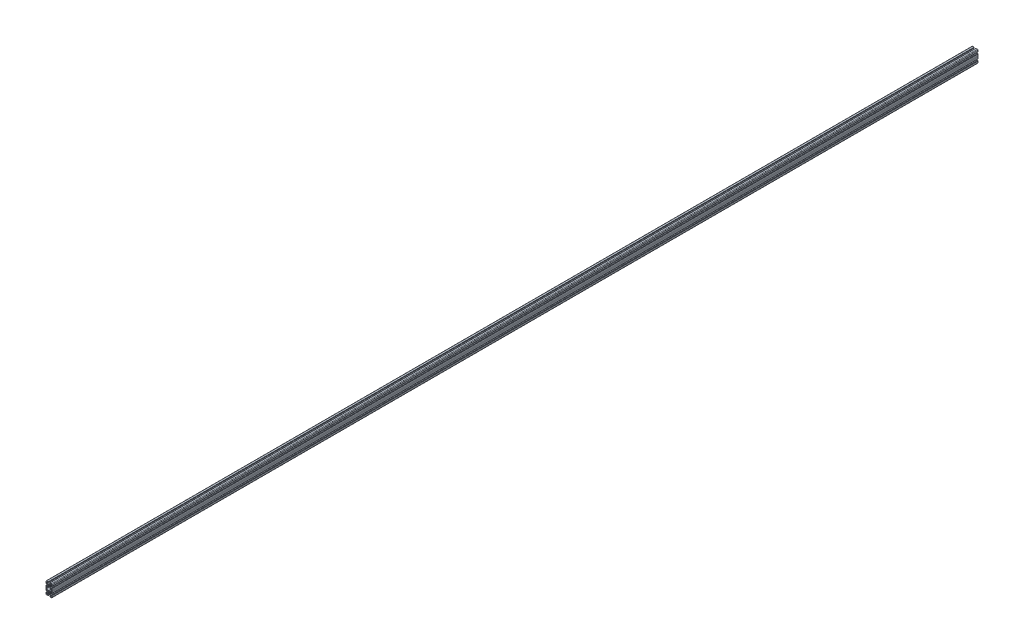
from build123d import *

# Parameters (mm, degrees)
SKETCH3_R           = 2.15
BOSS_EXTRUDE1_DEPTH = 1524
CIRPATTERN1_COUNT   = 2


with BuildPart() as part:
    # Sketch3 → Boss-Extrude1 (new, symmetric)
    with BuildSketch(Plane.XY):
        with BuildLine():
            Line((-8.30911066, 7.475083014), (-9.008684239, 7.499512662))
            ThreePointArc((-9.008684239, 7.499512662), (-9.582202525, 7.285082961), (-9.836116498, 6.727919597))
            Line((-9.836116498, 6.727919597), (-9.986803685, 2.412803152))
            ThreePointArc((-9.986803685, 2.412803152), (-9.995837451, 2.069746735), (-9.99898368, 1.726585818))
            Line((-9.99898368, 1.726585818), (-10, 0))
            Line((-10, 0), (-7.916458339, 0))
            ThreePointArc((-7.916458339, 0), (-7.764217404, 0.765366865), (-7.330671901, 1.414213562))
            Line((-7.330671901, 1.414213562), (-3.22356512, 5.521320344))
            ThreePointArc((-3.22356512, 5.521320344), (-2.250295073, 6.171638598), (-1.102244776, 6.4))
            Line((-1.102244776, 6.4), (1.102244776, 6.4))
            ThreePointArc((1.102244776, 6.4), (2.250295073, 6.171638598), (3.22356512, 5.521320344))
            Line((3.22356512, 5.521320344), (7.330671901, 1.414213562))
            ThreePointArc((7.330671901, 1.414213562), (7.764217404, 0.765366865), (7.916458339, 0))
            Line((7.916458339, 0), (10, 0))
            Line((10, 0), (9.99898368, 1.726585818))
            ThreePointArc((9.99898368, 1.726585818), (9.995837451, 2.069746735), (9.986803685, 2.412803152))
            Line((9.986803685, 2.412803152), (9.836116498, 6.727919597))
            ThreePointArc((9.836116498, 6.727919597), (9.582202525, 7.285082961), (9.008684239, 7.499512662))
            Line((9.008684239, 7.499512662), (8.30911066, 7.475083014))
            ThreePointArc((8.30911066, 7.475083014), (8.100174399, 7.379865274), (8.019763261, 7.164795917))
            Line((8.019763261, 7.164795917), (8.093719461, 5.046967452))
            ThreePointArc((8.093719461, 5.046967452), (7.631170264, 4.313871343), (6.779559917, 4.47555462))
            Line((6.779559917, 4.47555462), (4.478679656, 6.77643488))
            ThreePointArc((4.478679656, 6.77643488), (3.828361402, 7.749704927), (3.6, 8.897755224))
            Line((3.6, 8.897755224), (3.6, 11.102244776))
            ThreePointArc((3.6, 11.102244776), (3.828361402, 12.250295073), (4.478679656, 13.22356512))
            Line((4.478679656, 13.22356512), (6.779559917, 15.52444538))
            ThreePointArc((6.779559917, 15.52444538), (7.631170264, 15.686128657), (8.093719461, 14.953032548))
            Line((8.093719461, 14.953032548), (8.019763261, 12.835204083))
            ThreePointArc((8.019763261, 12.835204083), (8.100174399, 12.620134726), (8.30911066, 12.524916986))
            Line((8.30911066, 12.524916986), (9.008684239, 12.500487338))
            ThreePointArc((9.008684239, 12.500487338), (9.582202525, 12.714917039), (9.836116498, 13.272080403))
            Line((9.836116498, 13.272080403), (9.998781654, 17.930201007))
            ThreePointArc((9.998781654, 17.930201007), (9.414213562, 19.414213562), (7.930201007, 19.998781654))
            Line((7.930201007, 19.998781654), (3.272080403, 19.836116498))
            ThreePointArc((3.272080403, 19.836116498), (2.714917039, 19.582202525), (2.500487338, 19.008684239))
            Line((2.500487338, 19.008684239), (2.524916986, 18.30911066))
            ThreePointArc((2.524916986, 18.30911066), (2.620134726, 18.100174399), (2.835204083, 18.019763261))
            Line((2.835204083, 18.019763261), (4.953032548, 18.093719461))
            ThreePointArc((4.953032548, 18.093719461), (5.686128657, 17.631170264), (5.52444538, 16.779559917))
            Line((5.52444538, 16.779559917), (3.22356512, 14.478679656))
            ThreePointArc((3.22356512, 14.478679656), (2.250295073, 13.828361402), (1.102244776, 13.6))
            Line((1.102244776, 13.6), (-1.102244776, 13.6))
            ThreePointArc((-1.102244776, 13.6), (-2.250295073, 13.828361402), (-3.22356512, 14.478679656))
            Line((-3.22356512, 14.478679656), (-5.52444538, 16.779559917))
            ThreePointArc((-5.52444538, 16.779559917), (-5.686128657, 17.631170264), (-4.953032548, 18.093719461))
            Line((-4.953032548, 18.093719461), (-2.835204083, 18.019763261))
            ThreePointArc((-2.835204083, 18.019763261), (-2.620134726, 18.100174399), (-2.524916986, 18.30911066))
            Line((-2.524916986, 18.30911066), (-2.500487338, 19.008684239))
            ThreePointArc((-2.500487338, 19.008684239), (-2.714917039, 19.582202525), (-3.272080403, 19.836116498))
            Line((-3.272080403, 19.836116498), (-7.930201007, 19.998781654))
            ThreePointArc((-7.930201007, 19.998781654), (-9.414213562, 19.414213562), (-9.998781654, 17.930201007))
            Line((-9.998781654, 17.930201007), (-9.836116498, 13.272080403))
            ThreePointArc((-9.836116498, 13.272080403), (-9.582202525, 12.714917039), (-9.008684239, 12.500487338))
            Line((-9.008684239, 12.500487338), (-8.30911066, 12.524916986))
            ThreePointArc((-8.30911066, 12.524916986), (-8.100174399, 12.620134726), (-8.019763261, 12.835204083))
            Line((-8.019763261, 12.835204083), (-8.093719461, 14.953032548))
            ThreePointArc((-8.093719461, 14.953032548), (-7.631170264, 15.686128657), (-6.779559917, 15.52444538))
            Line((-6.779559917, 15.52444538), (-4.478679656, 13.22356512))
            ThreePointArc((-4.478679656, 13.22356512), (-3.828361402, 12.250295073), (-3.6, 11.102244776))
            Line((-3.6, 11.102244776), (-3.6, 8.897755224))
            ThreePointArc((-3.6, 8.897755224), (-3.828361402, 7.749704927), (-4.478679656, 6.77643488))
            Line((-4.478679656, 6.77643488), (-6.779559917, 4.47555462))
            ThreePointArc((-6.779559917, 4.47555462), (-7.631170264, 4.313871343), (-8.093719461, 5.046967452))
            Line((-8.093719461, 5.046967452), (-8.019763261, 7.164795917))
            ThreePointArc((-8.019763261, 7.164795917), (-8.100174399, 7.379865274), (-8.30911066, 7.475083014))
        make_face()
        with Locations((0, 10)):
            Circle(SKETCH3_R, mode=Mode.SUBTRACT)
    boss_extrude1 = extrude(amount=BOSS_EXTRUDE1_DEPTH, both=True)

    # CirPattern1: Boss-Extrude1 ×2 about axis
    cirpattern1_axis = Axis((0, 0, 0), (0, 0, 1))
    for i in range(1, CIRPATTERN1_COUNT):
        add(boss_extrude1.rotate(cirpattern1_axis, i * 360 / CIRPATTERN1_COUNT))


solid = part.part
